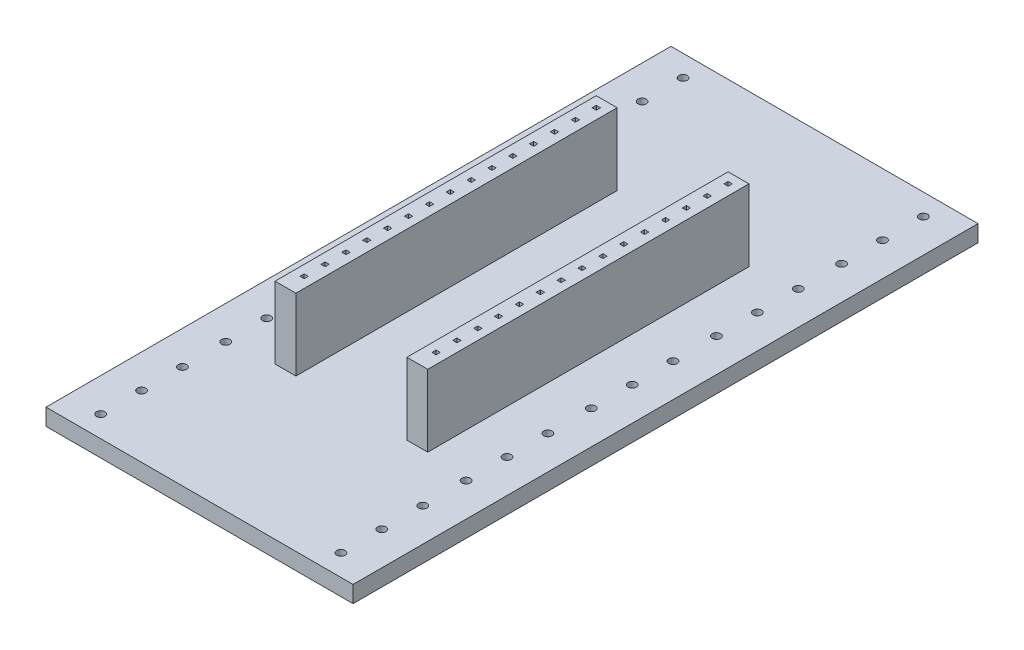
from build123d import *

# Parameters (mm, degrees)
CROQUIS1_W                = 36.8
CROQUIS1_H                = 74.9
SALIENTE_EXTRUIR1_DEPTH   = 2
CROQUIS3_R                = 0.5
CORTAR_EXTRUIR1_DEPTH     = 2
MATRIZL1_COUNT            = 2
MATRIZL1_PITCH            = 28.8
MATRIZL1_COUNT_DIR2       = 3
MATRIZL1_PITCH_DIR2       = 4.9
CROQUIS4_W                = 2.5
CROQUIS4_H                = 38.5
SALIENTE_EXTRUIR2_DEPTH   = 8.6
CROQUIS5_W                = 0.5
CROQUIS5_H                = 0.5
CORTAR_EXTRUIR2_DEPTH     = 6
MATRIZL5_COUNT            = 2
MATRIZL5_PITCH            = 15.8
MATRIZL5_COUNT_DIR2       = 15
MATRIZL5_PITCH_DIR2       = 2.5
MATRIZL6_COUNT            = 5
MATRIZL6_PITCH            = 15
MATRIZL6_COPY_1_SKETCH_R  = 0.5
MATRIZL6_COPY_1_DEPTH     = 2
MATRIZL6_COPY_2_SKETCH_R  = 0.5
MATRIZL6_COPY_2_DEPTH     = 2
MATRIZL6_COPY_3_SKETCH_R  = 0.5
MATRIZL6_COPY_3_DEPTH     = 2
MATRIZL6_COPY_4_SKETCH_R  = 0.5
MATRIZL6_COPY_4_DEPTH     = 2
MATRIZL6_COPY_5_SKETCH_R  = 0.5
MATRIZL6_COPY_5_DEPTH     = 2
MATRIZL6_COPY_6_SKETCH_R  = 0.5
MATRIZL6_COPY_6_DEPTH     = 2
MATRIZL6_COPY_7_SKETCH_R  = 0.5
MATRIZL6_COPY_7_DEPTH     = 2
MATRIZL6_COPY_8_SKETCH_R  = 0.5
MATRIZL6_COPY_8_DEPTH     = 2
MATRIZL6_COPY_9_SKETCH_R  = 0.5
MATRIZL6_COPY_9_DEPTH     = 2
MATRIZL6_COPY_10_SKETCH_R = 0.5
MATRIZL6_COPY_10_DEPTH    = 2
MATRIZL6_COPY_11_SKETCH_R = 0.5
MATRIZL6_COPY_11_DEPTH    = 2
MATRIZL6_COPY_12_SKETCH_R = 0.5
MATRIZL6_COPY_12_DEPTH    = 2
MATRIZL6_COPY_13_SKETCH_R = 0.5
MATRIZL6_COPY_13_DEPTH    = 2
MATRIZL6_COPY_14_SKETCH_R = 0.5
MATRIZL6_COPY_14_DEPTH    = 2
MATRIZL6_COPY_15_SKETCH_R = 0.5
MATRIZL6_COPY_15_DEPTH    = 2
MATRIZL6_COPY_16_SKETCH_R = 0.5
MATRIZL6_COPY_16_DEPTH    = 2
MATRIZL6_COPY_17_SKETCH_R = 0.5
MATRIZL6_COPY_17_DEPTH    = 2
MATRIZL6_COPY_18_SKETCH_R = 0.5
MATRIZL6_COPY_18_DEPTH    = 2
MATRIZL6_COPY_19_SKETCH_R = 0.5
MATRIZL6_COPY_19_DEPTH    = 2
MATRIZL6_COPY_20_SKETCH_R = 0.5
MATRIZL6_COPY_20_DEPTH    = 2


with BuildPart() as part:
    # Croquis1 → Saliente-Extruir1 (new body)
    with BuildSketch(Plane(origin=(0, 0, 0), x_dir=(1, 0, 0), z_dir=(0, 1, 0))):
        Rectangle(CROQUIS1_W, CROQUIS1_H)
    extrude(amount=SALIENTE_EXTRUIR1_DEPTH)

    # Croquis3 → Cortar-Extruir1 (cut)
    with BuildSketch(Plane(origin=(0, 2, 0), x_dir=(1, 0, 0), z_dir=(0, 1, 0))):
        with Locations(Location((-14.4, 34.9, 0), (0, 0, 270))):
            Circle(CROQUIS3_R)
    cortar_extruir1 = extrude(amount=-CORTAR_EXTRUIR1_DEPTH, mode=Mode.SUBTRACT)

    # MatrizL1: Cortar-Extruir1 2 × 3
    with Locations(*[(i * MATRIZL1_PITCH, 0, j * MATRIZL1_PITCH_DIR2) for i in range(MATRIZL1_COUNT) for j in range(MATRIZL1_COUNT_DIR2) if (i, j) != (0, 0)]):
        add(cortar_extruir1, mode=Mode.SUBTRACT)

    # Croquis4 → Saliente-Extruir2 (add)
    with BuildSketch(Plane(origin=(0, 2, 0), x_dir=(1, 0, 0), z_dir=(0, 1, 0))):
        with Locations((-7.9, 0)):
            Rectangle(CROQUIS4_W, CROQUIS4_H)
        with Locations((7.9, 0)):
            Rectangle(CROQUIS4_W, CROQUIS4_H)
    extrude(amount=SALIENTE_EXTRUIR2_DEPTH)

    # Croquis5 → Cortar-Extruir2 (cut)
    with BuildSketch(Plane(origin=(0, 10.6, 0), x_dir=(1, 0, 0), z_dir=(0, 1, 0))):
        with Locations((-7.9, 18)):
            Rectangle(CROQUIS5_W, CROQUIS5_H)
    cortar_extruir2 = extrude(amount=-CORTAR_EXTRUIR2_DEPTH, mode=Mode.SUBTRACT)

    # MatrizL5: Cortar-Extruir2 2 × 15
    with Locations(*[(i * MATRIZL5_PITCH, 0, j * MATRIZL5_PITCH_DIR2) for i in range(MATRIZL5_COUNT) for j in range(MATRIZL5_COUNT_DIR2) if (i, j) != (0, 0)]):
        add(cortar_extruir2, mode=Mode.SUBTRACT)

    # MatrizL6: Cortar-Extruir1 ×5
    with Locations(*[(0, 0, i * MATRIZL6_PITCH) for i in range(1, MATRIZL6_COUNT)]):
        add(cortar_extruir1, mode=Mode.SUBTRACT)

    # MatrizL6 copy 1 sketch → MatrizL6 copy 1 (cut)
    with BuildSketch(Plane(origin=(0, 2, 19.9), x_dir=(1, 0, 0), z_dir=(0, 1, 0))):
        with Locations(Location((-14.4, 34.9, 0), (0, 0, 270))):
            Circle(MATRIZL6_COPY_1_SKETCH_R)
    extrude(amount=-MATRIZL6_COPY_1_DEPTH, mode=Mode.SUBTRACT)

    # MatrizL6 copy 2 sketch → MatrizL6 copy 2 (cut)
    with BuildSketch(Plane(origin=(0, 2, 34.9), x_dir=(1, 0, 0), z_dir=(0, 1, 0))):
        with Locations(Location((-14.4, 34.9, 0), (0, 0, 270))):
            Circle(MATRIZL6_COPY_2_SKETCH_R)
    extrude(amount=-MATRIZL6_COPY_2_DEPTH, mode=Mode.SUBTRACT)

    # MatrizL6 copy 3 sketch → MatrizL6 copy 3 (cut)
    with BuildSketch(Plane(origin=(0, 2, 49.9), x_dir=(1, 0, 0), z_dir=(0, 1, 0))):
        with Locations(Location((-14.4, 34.9, 0), (0, 0, 270))):
            Circle(MATRIZL6_COPY_3_SKETCH_R)
    extrude(amount=-MATRIZL6_COPY_3_DEPTH, mode=Mode.SUBTRACT)

    # MatrizL6 copy 4 sketch → MatrizL6 copy 4 (cut)
    with BuildSketch(Plane(origin=(0, 2, 64.9), x_dir=(1, 0, 0), z_dir=(0, 1, 0))):
        with Locations(Location((-14.4, 34.9, 0), (0, 0, 270))):
            Circle(MATRIZL6_COPY_4_SKETCH_R)
    extrude(amount=-MATRIZL6_COPY_4_DEPTH, mode=Mode.SUBTRACT)

    # MatrizL6 copy 5 sketch → MatrizL6 copy 5 (cut)
    with BuildSketch(Plane(origin=(0, 2, 24.8), x_dir=(1, 0, 0), z_dir=(0, 1, 0))):
        with Locations(Location((-14.4, 34.9, 0), (0, 0, 270))):
            Circle(MATRIZL6_COPY_5_SKETCH_R)
    extrude(amount=-MATRIZL6_COPY_5_DEPTH, mode=Mode.SUBTRACT)

    # MatrizL6 copy 6 sketch → MatrizL6 copy 6 (cut)
    with BuildSketch(Plane(origin=(0, 2, 39.8), x_dir=(1, 0, 0), z_dir=(0, 1, 0))):
        with Locations(Location((-14.4, 34.9, 0), (0, 0, 270))):
            Circle(MATRIZL6_COPY_6_SKETCH_R)
    extrude(amount=-MATRIZL6_COPY_6_DEPTH, mode=Mode.SUBTRACT)

    # MatrizL6 copy 7 sketch → MatrizL6 copy 7 (cut)
    with BuildSketch(Plane(origin=(0, 2, 54.8), x_dir=(1, 0, 0), z_dir=(0, 1, 0))):
        with Locations(Location((-14.4, 34.9, 0), (0, 0, 270))):
            Circle(MATRIZL6_COPY_7_SKETCH_R)
    extrude(amount=-MATRIZL6_COPY_7_DEPTH, mode=Mode.SUBTRACT)

    # MatrizL6 copy 8 sketch → MatrizL6 copy 8 (cut)
    with BuildSketch(Plane(origin=(0, 2, 69.8), x_dir=(1, 0, 0), z_dir=(0, 1, 0))):
        with Locations(Location((-14.4, 34.9, 0), (0, 0, 270))):
            Circle(MATRIZL6_COPY_8_SKETCH_R)
    extrude(amount=-MATRIZL6_COPY_8_DEPTH, mode=Mode.SUBTRACT)

    # MatrizL6 copy 9 sketch → MatrizL6 copy 9 (cut)
    with BuildSketch(Plane(origin=(28.8, 2, 15), x_dir=(1, 0, 0), z_dir=(0, 1, 0))):
        with Locations(Location((-14.4, 34.9, 0), (0, 0, 270))):
            Circle(MATRIZL6_COPY_9_SKETCH_R)
    extrude(amount=-MATRIZL6_COPY_9_DEPTH, mode=Mode.SUBTRACT)

    # MatrizL6 copy 10 sketch → MatrizL6 copy 10 (cut)
    with BuildSketch(Plane(origin=(28.8, 2, 30), x_dir=(1, 0, 0), z_dir=(0, 1, 0))):
        with Locations(Location((-14.4, 34.9, 0), (0, 0, 270))):
            Circle(MATRIZL6_COPY_10_SKETCH_R)
    extrude(amount=-MATRIZL6_COPY_10_DEPTH, mode=Mode.SUBTRACT)

    # MatrizL6 copy 11 sketch → MatrizL6 copy 11 (cut)
    with BuildSketch(Plane(origin=(28.8, 2, 45), x_dir=(1, 0, 0), z_dir=(0, 1, 0))):
        with Locations(Location((-14.4, 34.9, 0), (0, 0, 270))):
            Circle(MATRIZL6_COPY_11_SKETCH_R)
    extrude(amount=-MATRIZL6_COPY_11_DEPTH, mode=Mode.SUBTRACT)

    # MatrizL6 copy 12 sketch → MatrizL6 copy 12 (cut)
    with BuildSketch(Plane(origin=(28.8, 2, 60), x_dir=(1, 0, 0), z_dir=(0, 1, 0))):
        with Locations(Location((-14.4, 34.9, 0), (0, 0, 270))):
            Circle(MATRIZL6_COPY_12_SKETCH_R)
    extrude(amount=-MATRIZL6_COPY_12_DEPTH, mode=Mode.SUBTRACT)

    # MatrizL6 copy 13 sketch → MatrizL6 copy 13 (cut)
    with BuildSketch(Plane(origin=(28.8, 2, 19.9), x_dir=(1, 0, 0), z_dir=(0, 1, 0))):
        with Locations(Location((-14.4, 34.9, 0), (0, 0, 270))):
            Circle(MATRIZL6_COPY_13_SKETCH_R)
    extrude(amount=-MATRIZL6_COPY_13_DEPTH, mode=Mode.SUBTRACT)

    # MatrizL6 copy 14 sketch → MatrizL6 copy 14 (cut)
    with BuildSketch(Plane(origin=(28.8, 2, 34.9), x_dir=(1, 0, 0), z_dir=(0, 1, 0))):
        with Locations(Location((-14.4, 34.9, 0), (0, 0, 270))):
            Circle(MATRIZL6_COPY_14_SKETCH_R)
    extrude(amount=-MATRIZL6_COPY_14_DEPTH, mode=Mode.SUBTRACT)

    # MatrizL6 copy 15 sketch → MatrizL6 copy 15 (cut)
    with BuildSketch(Plane(origin=(28.8, 2, 49.9), x_dir=(1, 0, 0), z_dir=(0, 1, 0))):
        with Locations(Location((-14.4, 34.9, 0), (0, 0, 270))):
            Circle(MATRIZL6_COPY_15_SKETCH_R)
    extrude(amount=-MATRIZL6_COPY_15_DEPTH, mode=Mode.SUBTRACT)

    # MatrizL6 copy 16 sketch → MatrizL6 copy 16 (cut)
    with BuildSketch(Plane(origin=(28.8, 2, 64.9), x_dir=(1, 0, 0), z_dir=(0, 1, 0))):
        with Locations(Location((-14.4, 34.9, 0), (0, 0, 270))):
            Circle(MATRIZL6_COPY_16_SKETCH_R)
    extrude(amount=-MATRIZL6_COPY_16_DEPTH, mode=Mode.SUBTRACT)

    # MatrizL6 copy 17 sketch → MatrizL6 copy 17 (cut)
    with BuildSketch(Plane(origin=(28.8, 2, 24.8), x_dir=(1, 0, 0), z_dir=(0, 1, 0))):
        with Locations(Location((-14.4, 34.9, 0), (0, 0, 270))):
            Circle(MATRIZL6_COPY_17_SKETCH_R)
    extrude(amount=-MATRIZL6_COPY_17_DEPTH, mode=Mode.SUBTRACT)

    # MatrizL6 copy 18 sketch → MatrizL6 copy 18 (cut)
    with BuildSketch(Plane(origin=(28.8, 2, 39.8), x_dir=(1, 0, 0), z_dir=(0, 1, 0))):
        with Locations(Location((-14.4, 34.9, 0), (0, 0, 270))):
            Circle(MATRIZL6_COPY_18_SKETCH_R)
    extrude(amount=-MATRIZL6_COPY_18_DEPTH, mode=Mode.SUBTRACT)

    # MatrizL6 copy 19 sketch → MatrizL6 copy 19 (cut)
    with BuildSketch(Plane(origin=(28.8, 2, 54.8), x_dir=(1, 0, 0), z_dir=(0, 1, 0))):
        with Locations(Location((-14.4, 34.9, 0), (0, 0, 270))):
            Circle(MATRIZL6_COPY_19_SKETCH_R)
    extrude(amount=-MATRIZL6_COPY_19_DEPTH, mode=Mode.SUBTRACT)

    # MatrizL6 copy 20 sketch → MatrizL6 copy 20 (cut)
    with BuildSketch(Plane(origin=(28.8, 2, 69.8), x_dir=(1, 0, 0), z_dir=(0, 1, 0))):
        with Locations(Location((-14.4, 34.9, 0), (0, 0, 270))):
            Circle(MATRIZL6_COPY_20_SKETCH_R)
    extrude(amount=-MATRIZL6_COPY_20_DEPTH, mode=Mode.SUBTRACT)


solid = part.part
